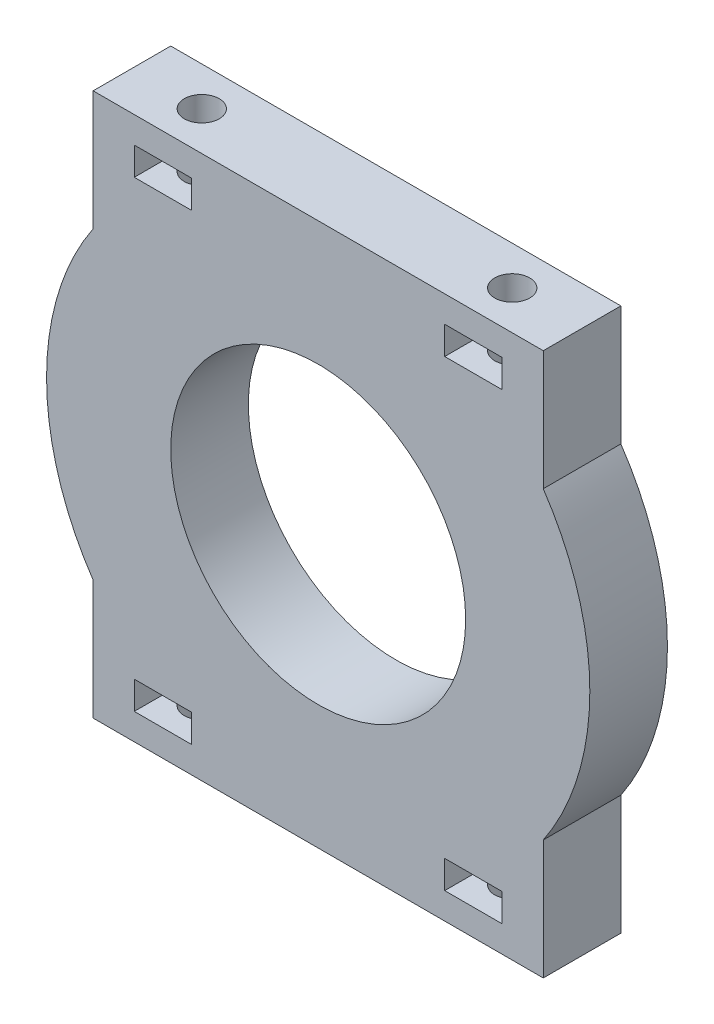
from build123d import *

# Parameters (mm, degrees)
CROQUIS1_R              = 19
SALIENTE_EXTRUIR1_DEPTH = 5
CORTAR_EXTRUIR1_DEPTH   = 3.6
CROQUIS6_R              = 2.25
CORTAR_EXTRUIR2_DEPTH   = 10


with BuildPart() as part:
    # Croquis1 → Saliente-Extruir1 (new, symmetric)
    with BuildSketch(Plane.XY):
        with BuildLine():
            Line((-29, 19.595917942), (-29, 35))
            Line((-29, 35), (29, 35))
            Line((29, 35), (29, 19.595917942))
            ThreePointArc((29, 19.595917942), (35, 0), (29, -19.595917942))
            Line((29, -19.595917942), (29, -35))
            Line((29, -35), (-29, -35))
            Line((-29, -35), (-29, -19.595917942))
            ThreePointArc((-29, -19.595917942), (-35, 0), (-29, 19.595917942))
        make_face()
        Circle(CROQUIS1_R, mode=Mode.SUBTRACT)
    extrude(amount=SALIENTE_EXTRUIR1_DEPTH, both=True)

    # Croquis5 → Cortar-Extruir1 (cut)
    with BuildSketch(Plane(origin=(0, 28, 0), x_dir=(1, 0, 0), z_dir=(0, 1, 0))):
        Polygon((-23.7, -2.136195996), (-23.7, -5), (-16.3, -5), (-16.3, -2.136195996), (-16.3, 2.136195996), (-20, 4.272391992), (-23.7, 2.136195996), align=None)
        Polygon((16.3, 2.136195996), (16.3, -2.136195996), (16.3, -5), (23.7, -5), (23.7, -2.136195996), (23.7, 2.136195996), (20, 4.272391992), align=None)
    cortar_extruir1 = extrude(amount=CORTAR_EXTRUIR1_DEPTH, mode=Mode.SUBTRACT)

    # Croquis6 → Cortar-Extruir2 (cut)
    with BuildSketch(Plane(origin=(0, 35, 0), x_dir=(1, 0, 0), z_dir=(0, 1, 0))):
        with Locations(Location((-20, 0, 0), (0, 0, 270))):
            Circle(CROQUIS6_R)
        with Locations(Location((20, 0, 0), (0, 0, 270))):
            Circle(CROQUIS6_R)
    cortar_extruir2 = extrude(amount=-CORTAR_EXTRUIR2_DEPTH, mode=Mode.SUBTRACT)

    # Simetría1: Cortar-Extruir1, Cortar-Extruir2 across plane
    add(cortar_extruir1.mirror(Plane.ZX), mode=Mode.SUBTRACT)
    add(cortar_extruir2.mirror(Plane.ZX), mode=Mode.SUBTRACT)


solid = part.part
